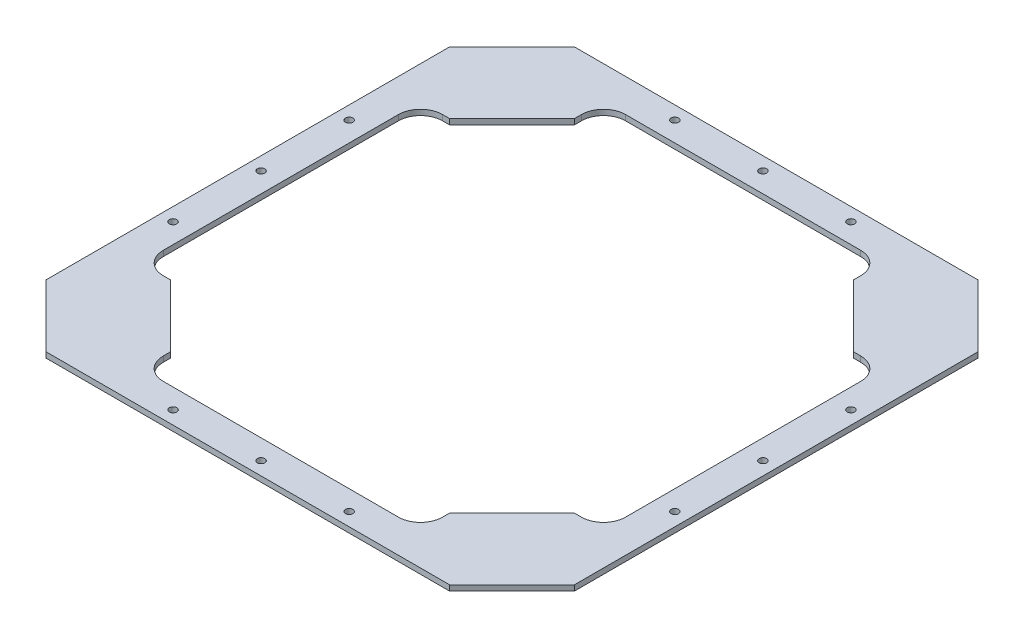
from build123d import *

# Parameters (mm, degrees)
BOSS_EXTRUDE1_DEPTH = 3.175
SKETCH4_R           = 2.159
CUT_EXTRUDE2_DEPTH  = 216.549531721


with BuildPart() as part:
    # Sketch2 → Boss-Extrude1 (new body)
    with BuildSketch(Plane(origin=(0, 0, 0), x_dir=(1, 0, 0), z_dir=(0, 1, 0))):
        Polygon((-152.4, 116.478975516), (-116.478975516, 152.4), (116.478975516, 152.4), (152.4, 116.478975516), (152.4, -116.478975516), (116.478975516, -152.4), (-116.478975516, -152.4), (-152.4, -116.478975516), align=None)
        with BuildLine():
            Line((-116.478975516, 80.557951031), (-80.557951031, 116.478975516))
            Line((-80.557951031, 116.478975516), (-80.557951031, 120.65))
            ThreePointArc((-80.557951031, 120.65), (-76.838207153, 129.630256121), (-67.857951031, 133.35))
            Line((-67.857951031, 133.35), (67.857951031, 133.35))
            ThreePointArc((67.857951031, 133.35), (76.838207153, 129.630256121), (80.557951031, 120.65))
            Line((80.557951031, 120.65), (80.557951031, 116.478975516))
            Line((80.557951031, 116.478975516), (116.478975516, 80.557951031))
            Line((116.478975516, 80.557951031), (120.65, 80.557951031))
            ThreePointArc((120.65, 80.557951031), (129.630256121, 76.838207153), (133.35, 67.857951031))
            Line((133.35, 67.857951031), (133.35, -67.857951031))
            ThreePointArc((133.35, -67.857951031), (129.630256121, -76.838207153), (120.65, -80.557951031))
            Line((120.65, -80.557951031), (116.478975516, -80.557951031))
            Line((116.478975516, -80.557951031), (80.557951031, -116.478975516))
            Line((80.557951031, -116.478975516), (80.557951031, -120.65))
            ThreePointArc((80.557951031, -120.65), (76.838207153, -129.630256121), (67.857951031, -133.35))
            Line((67.857951031, -133.35), (-67.857951031, -133.35))
            ThreePointArc((-67.857951031, -133.35), (-76.838207153, -129.630256121), (-80.557951031, -120.65))
            Line((-80.557951031, -120.65), (-80.557951031, -116.478975516))
            Line((-80.557951031, -116.478975516), (-116.478975516, -80.557951031))
            Line((-116.478975516, -80.557951031), (-120.65, -80.557951031))
            ThreePointArc((-120.65, -80.557951031), (-129.630256121, -76.838207153), (-133.35, -67.857951031))
            Line((-133.35, -67.857951031), (-133.35, 67.857951031))
            ThreePointArc((-133.35, 67.857951031), (-129.630256121, 76.838207153), (-120.65, 80.557951031))
            Line((-120.65, 80.557951031), (-116.478975516, 80.557951031))
        make_face(mode=Mode.SUBTRACT)
    extrude(amount=BOSS_EXTRUDE1_DEPTH)

    # Sketch4 → Cut-Extrude2 (cut, through all)
    with BuildSketch(Plane(origin=(0, 3.175, 0), x_dir=(1, 0, 0), z_dir=(0, 1, 0))):
        with Locations(Location((0, 144.78, 0), (0, 0, 270))):
            Circle(SKETCH4_R)
        with Locations(Location((-50.8, 144.78, 0), (0, 0, 270))):
            Circle(SKETCH4_R)
        with Locations(Location((-144.78, 50.8, 0), (0, 0, 270))):
            Circle(SKETCH4_R)
        with Locations(Location((-144.78, 0, 0), (0, 0, 270))):
            Circle(SKETCH4_R)
        with Locations(Location((144.78, 0, 0), (0, 0, 90))):
            Circle(SKETCH4_R)
        with Locations(Location((144.78, 50.8, 0), (0, 0, 90))):
            Circle(SKETCH4_R)
        with Locations(Location((50.8, 144.78, 0), (0, 0, 90))):
            Circle(SKETCH4_R)
        with Locations(Location((50.8, -144.78, 0), (0, 0, 270))):
            Circle(SKETCH4_R)
        with Locations(Location((144.78, -50.8, 0), (0, 0, 270))):
            Circle(SKETCH4_R)
        with Locations(Location((-50.8, -144.78, 0), (0, 0, 90))):
            Circle(SKETCH4_R)
        with Locations(Location((0, -144.78, 0), (0, 0, 90))):
            Circle(SKETCH4_R)
        with Locations(Location((-144.78, -50.8, 0), (0, 0, 90))):
            Circle(SKETCH4_R)
    extrude(amount=-CUT_EXTRUDE2_DEPTH, mode=Mode.SUBTRACT)


solid = part.part
